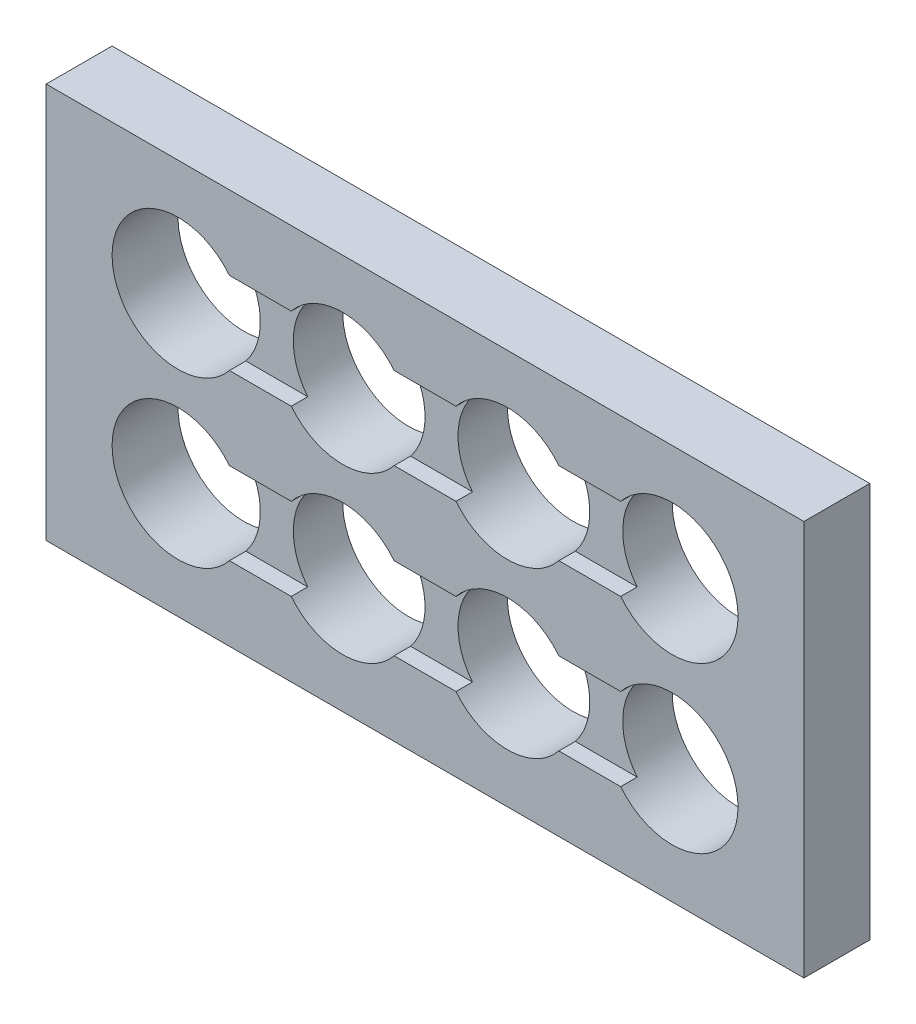
from build123d import *

# Parameters (mm, degrees)
SKICA1_W                 = 46
SKICA1_H                 = 24
SKICA1_R                 = 4
P_IDAT_VYSUNUT_M1_DEPTH  = 4
SKICA2_W                 = 30
SKICA2_H                 = 5
ODEBRAT_VYSUNUT_M1_DEPTH = 1


with BuildPart() as part:
    # Skica1 → Přidat vysunutím1 (new body)
    with BuildSketch(Plane.XY):
        Rectangle(SKICA1_W, SKICA1_H)
        with Locations((-15, -5)):
            Circle(SKICA1_R, mode=Mode.SUBTRACT)
        with Locations((-5, -5)):
            Circle(SKICA1_R, mode=Mode.SUBTRACT)
        with Locations((5, -5)):
            Circle(SKICA1_R, mode=Mode.SUBTRACT)
        with Locations((15, -5)):
            Circle(SKICA1_R, mode=Mode.SUBTRACT)
        with Locations((-5, 5)):
            Circle(SKICA1_R, mode=Mode.SUBTRACT)
        with Locations((5, 5)):
            Circle(SKICA1_R, mode=Mode.SUBTRACT)
        with Locations((15, 5)):
            Circle(SKICA1_R, mode=Mode.SUBTRACT)
        with Locations((-15, 5)):
            Circle(SKICA1_R, mode=Mode.SUBTRACT)
    extrude(amount=P_IDAT_VYSUNUT_M1_DEPTH)

    # Skica2 → Odebrat vysunutím1 (cut)
    with BuildSketch(Plane.XY.offset(4)):
        with Locations((0, 5)):
            Rectangle(SKICA2_W, SKICA2_H)
        with Locations((0, -5)):
            Rectangle(SKICA2_W, SKICA2_H)
    extrude(amount=-ODEBRAT_VYSUNUT_M1_DEPTH, mode=Mode.SUBTRACT)


solid = part.part
